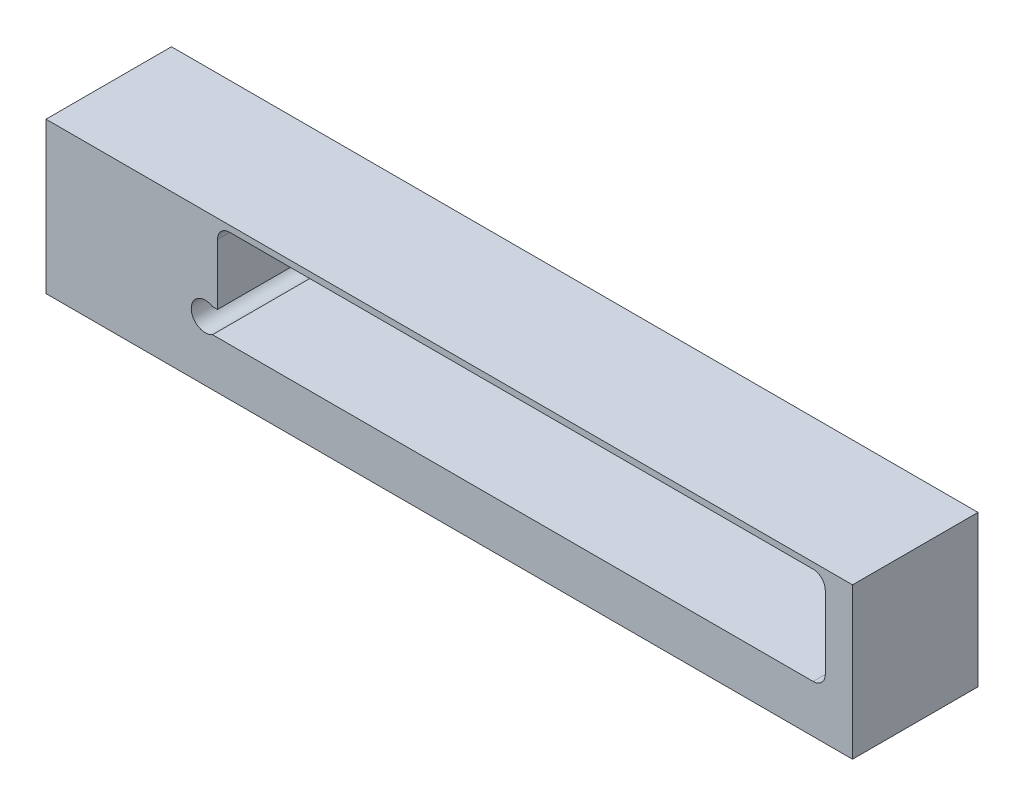
from build123d import *

# Parameters (mm, degrees)
SKETCH1_R           = 36
SKETCH1_R_2         = 20.52
BOSS_EXTRUDE1_DEPTH = 320
CUT_EXTRUDE1_START  = -310
CUT_EXTRUDE1_DEPTH  = 310
BOSS_EXTRUDE2_START = -155
SKETCH3_R           = 20.52
BOSS_EXTRUDE2_DEPTH = 155


with BuildPart() as part:
    # Sketch1 → Boss-Extrude1 (new body)
    with BuildSketch(Plane.XY):
        Polygon((-406.4, -152.64), (406.4, -152.64), (1650.508092605, -152.64), (1650.508092605, 232.64), (-406.4, 232.64), (-406.4, 152.64), align=None)
        Circle(SKETCH1_R, mode=Mode.SUBTRACT)
        with Locations((0, 95.04)):
            Circle(SKETCH1_R_2, mode=Mode.SUBTRACT)
        with Locations((0, -95.04)):
            Circle(SKETCH1_R_2, mode=Mode.SUBTRACT)
    extrude(amount=BOSS_EXTRUDE1_DEPTH)

    # Sketch2 → Cut-Extrude1 (cut)
    with BuildSketch(Plane.XY.offset(320).offset(CUT_EXTRUDE1_START)):
        with BuildLine():
            ThreePointArc((1550, -31), (1571.920310217, -21.920310217), (1581, 0))
            Line((1581, 0), (1581, 186))
            ThreePointArc((1581, 186), (1571.920310217, 207.920310217), (1550, 217))
            Line((1550, 217), (62, 217))
            ThreePointArc((62, 217), (40.079689783, 207.920310217), (31, 186))
            Line((31, 186), (31, 53.469630572))
            Line((31, 53.469630572), (31, 31))
            Line((31, 31), (18.303005218, 31))
            ThreePointArc((18.303005218, 31), (31.264262248, 17.847854383), (36, 0))
            ThreePointArc((36, 0), (31.264262248, -17.847854383), (18.303005218, -31))
            Line((18.303005218, -31), (1550, -31))
        make_face()
    extrude(amount=CUT_EXTRUDE1_DEPTH, mode=Mode.SUBTRACT)

    # Sketch3 → Boss-Extrude2 (add)
    with BuildSketch(Plane.XY.offset(320).offset(BOSS_EXTRUDE2_START)):
        with Locations((0, 95.04)):
            Circle(SKETCH3_R)
        with Locations((0, -95.04)):
            Circle(SKETCH3_R)
    extrude(amount=BOSS_EXTRUDE2_DEPTH)


solid = part.part
